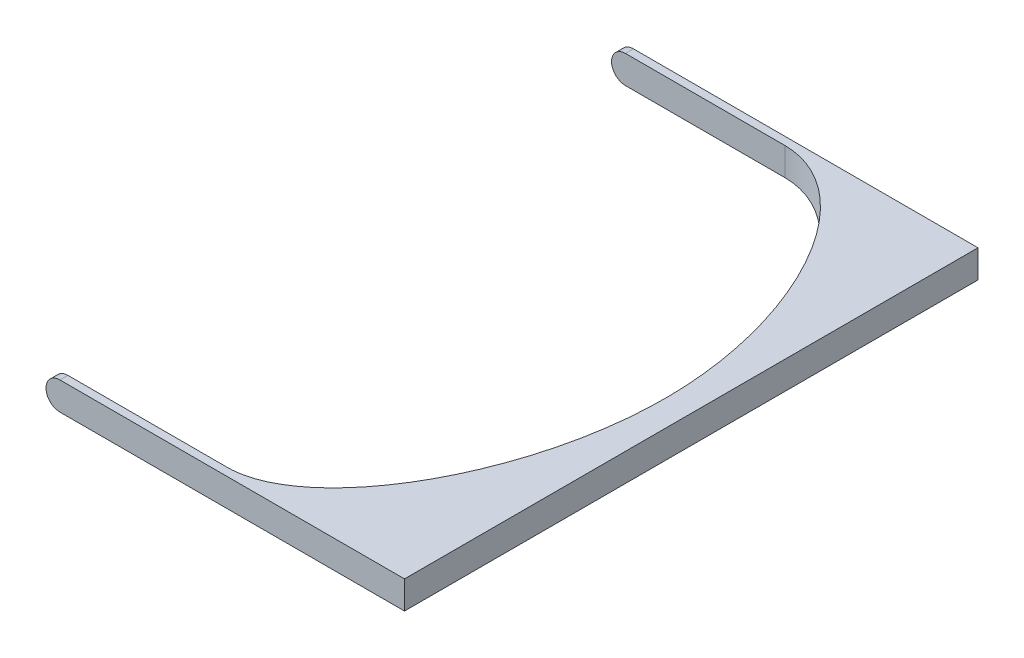
from build123d import *

# Parameters (mm, degrees)
BOSS_EXTRUDE1_DEPTH      = 182.88
BOSS_EXTRUDE1_DEPTH_BACK = 182.88
CUT_EXTRUDE1_DEPTH       = 177.8
CUT_EXTRUDE1_DEPTH_BACK  = 177.8
SKETCH1_5_OUTSIDE_W      = 316.984
SKETCH1_5_OUTSIDE_H      = 106.122
SKETCH1_5_OUTSIDE_R      = 3.81
CUT_EXTRUDE2_DEPTH       = 287.032982605
CUT_EXTRUDE2_DEPTH_BACK  = 287.032982605


with BuildPart() as part:
    # Sketch1 → Boss-Extrude1 (new, two sides: drawn at the far end of the back side and taken through both)
    with BuildSketch(Plane.XY.offset(-BOSS_EXTRUDE1_DEPTH_BACK)):
        with BuildLine():
            Line((0, 8.89), (219.75154297, 8.89))
            Line((219.75154297, 8.89), (219.75154297, -8.89))
            Line((219.75154297, -8.89), (0, -8.89))
            ThreePointArc((0, -8.89), (-8.89, 0), (0, 8.89))
        make_face()
    extrude(amount=BOSS_EXTRUDE1_DEPTH + BOSS_EXTRUDE1_DEPTH_BACK)

    # Sketch1<5> outside → Cut-Extrude1 (cut, two sides: drawn at the far end of the back side and taken through both)
    # profile 1 of 2: a face of its own
    with BuildSketch(Plane.XY.offset(-CUT_EXTRUDE1_DEPTH_BACK)):
        with Locations((105.431, 0)):
            Rectangle(SKETCH1_5_OUTSIDE_W, SKETCH1_5_OUTSIDE_H)
        with BuildLine():
            Line((0, 8.89), (219.75154297, 8.89))
            Line((219.75154297, 8.89), (219.75154297, -8.89))
            Line((219.75154297, -8.89), (0, -8.89))
            ThreePointArc((0, -8.89), (-8.89, 0), (0, 8.89))
        make_face(mode=Mode.SUBTRACT)
    # profile 2 of 2: a face of its own
    with BuildSketch(Plane.XY.offset(-CUT_EXTRUDE1_DEPTH_BACK)):
        Circle(SKETCH1_5_OUTSIDE_R)
    extrude(amount=CUT_EXTRUDE1_DEPTH + CUT_EXTRUDE1_DEPTH_BACK, mode=Mode.SUBTRACT)

    # Sketch3 → Cut-Extrude2 (cut, two sides: drawn at the far end of the back side and taken through both)
    with BuildSketch(Plane(origin=(0, 0, 0), x_dir=(1, 0, 0), z_dir=(0, 1, 0)).offset(-CUT_EXTRUDE2_DEPTH_BACK)):
        with BuildLine():
            Line((-101.6, 177.8), (101.6, 177.8))
            add(Edge.make_bspline(
                [(101.6, 177.8), (152.4, 177.8), (254, 0), (152.4, -177.8), (101.6, -177.8)],
                knots=[0, 0, 0, 0, 0.5, 1, 1, 1, 1], degree=3))
            Line((101.6, -177.8), (-101.6, -177.8))
            Line((-101.6, -177.8), (-101.6, 177.8))
        make_face()
    extrude(amount=CUT_EXTRUDE2_DEPTH + CUT_EXTRUDE2_DEPTH_BACK, mode=Mode.SUBTRACT)


solid = part.part
